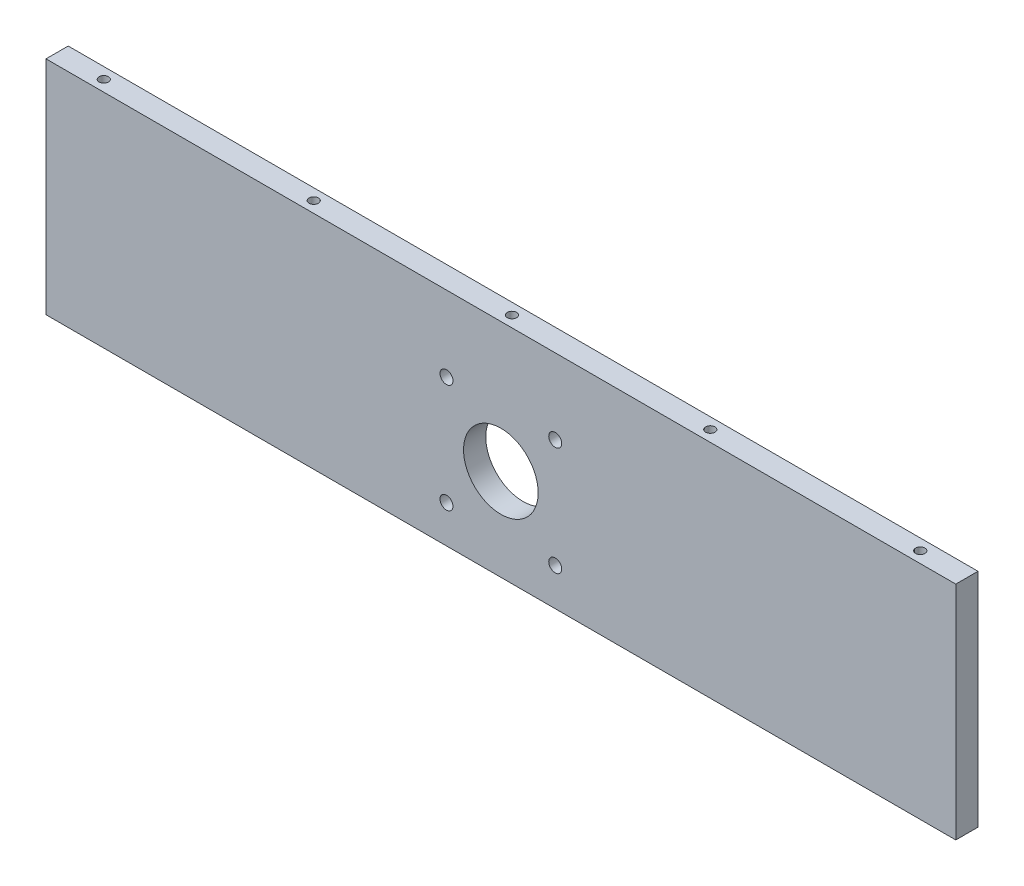
from build123d import *

# Parameters (mm, degrees)
ESBO_O1_W                = 390
ESBO_O1_H                = 95
RESSALTO_EXTRUS_O1_DEPTH = 9.525
ESBO_O3_R                = 16
CORTE_EXTRUS_O2_DEPTH    = 9.525
ESBO_O17_R               = 2.78
CORTE_EXTRUS_O12_DEPTH   = 9.525
ESBO_O18_R               = 2
CORTE_EXTRUS_O13_DEPTH   = 20
CORTE_EXTRUS_O14_START   = -20
ESBO_O19_R               = 2
CORTE_EXTRUS_O14_DEPTH   = 20


with BuildPart() as part:
    # Esboço1 → Ressalto-extrusão1 (new body)
    with BuildSketch(Plane.XY):
        Rectangle(ESBO_O1_W, ESBO_O1_H)
    extrude(amount=RESSALTO_EXTRUS_O1_DEPTH)

    # Esboço3 → Corte-extrusão2 (cut)
    with BuildSketch(Plane.XY.offset(9.525)):
        with Locations((-0.011971039, -8.12)):
            Circle(ESBO_O3_R)
    extrude(amount=-CORTE_EXTRUS_O2_DEPTH, mode=Mode.SUBTRACT)

    # Esboço17 → Corte-extrusão12 (cut)
    with BuildSketch(Plane(origin=(0, 0, 0), x_dir=(-1, 0, 0), z_dir=(0, 0, -1))):
        with Locations((23.311971039, -31.42)):
            Circle(ESBO_O17_R)
        with Locations((-23.288028961, -31.42)):
            Circle(ESBO_O17_R)
        with Locations((23.311971039, 15.18)):
            Circle(ESBO_O17_R)
        with Locations((-23.288028961, 15.18)):
            Circle(ESBO_O17_R)
    extrude(amount=-CORTE_EXTRUS_O12_DEPTH, mode=Mode.SUBTRACT)

    # Esboço18 → Corte-extrusão13 (cut)
    with BuildSketch(Plane(origin=(0, 47.5, 0), x_dir=(-1, 0, 0), z_dir=(0, 1, 0))):
        with Locations(Location((-175, 4.7625, 0), (0, 0, 90))):
            Circle(ESBO_O18_R)
        with Locations(Location((-85, 4.7625, 0), (0, 0, 90))):
            Circle(ESBO_O18_R)
        with Locations(Location((0, 4.7625, 0), (0, 0, 90))):
            Circle(ESBO_O18_R)
        with Locations(Location((175, 4.7625, 0), (0, 0, 270))):
            Circle(ESBO_O18_R)
        with Locations(Location((85, 4.7625, 0), (0, 0, 270))):
            Circle(ESBO_O18_R)
    extrude(amount=-CORTE_EXTRUS_O13_DEPTH, mode=Mode.SUBTRACT)

    # Esboço19 → Corte-extrusão14 (cut)
    with BuildSketch(Plane.XZ.offset(47.5).offset(CORTE_EXTRUS_O14_START)):
        with Locations(Location((-115, 4.7625, 0), (0, 0, 270))):
            Circle(ESBO_O19_R)
        with Locations(Location((0, 4.7625, 0), (0, 0, 90))):
            Circle(ESBO_O19_R)
        with Locations(Location((115, 4.7625, 0), (0, 0, 270))):
            Circle(ESBO_O19_R)
    extrude(amount=CORTE_EXTRUS_O14_DEPTH, mode=Mode.SUBTRACT)


solid = part.part
